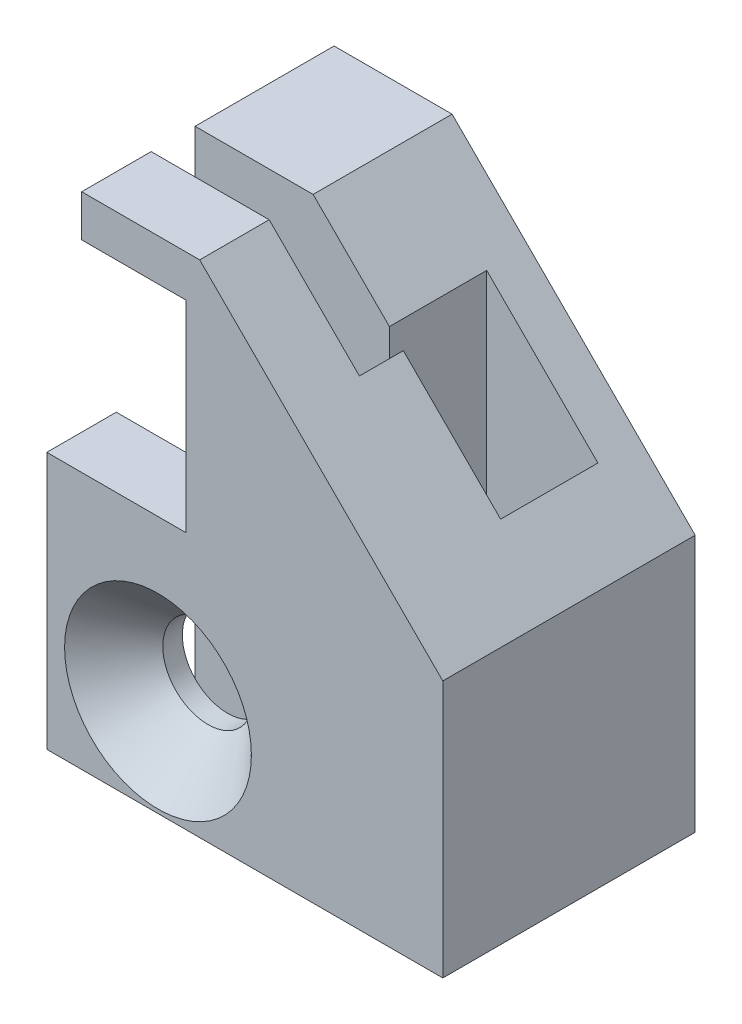
from build123d import *

# Parameters (mm, degrees)
CROQUIS1_R              = 1.625
SALIENTE_EXTRUIR1_DEPTH = 2.5
SALIENTE_EXTRUIR2_DEPTH = 1.58
SALIENTE_EXTRUIR3_START = 3.5
CROQUIS3_R              = 1.625
SALIENTE_EXTRUIR3_DEPTH = 3.5
SALIENTE_EXTRUIR4_START = 1.5
CROQUIS5_R              = 1.625
SALIENTE_EXTRUIR4_DEPTH = 1.5
CORTAR_EXTRUIR1_REACH   = 129.692
CROQUIS6_W              = 3.24530053
CROQUIS6_H              = 1.58
SALIENTE_EXTRUIR5_START = -2.5
CROQUIS7_W              = 1.25469947
CROQUIS7_H              = 9.25469947
SALIENTE_EXTRUIR5_DEPTH = 2.5
CROQUIS8_R              = 3.35997123
CORTAR_EXTRUIR2_DEPTH   = 1.8
CORTAR_EXTRUIR2_DRAFT   = -44
CORTAR_EXTRUIR3_DEPTH   = 2.5


with BuildPart() as part:
    # Croquis1 → Saliente-Extruir1 (new body)
    with BuildSketch(Plane.XY):
        Polygon((-126.24514053, -73.999935), (-113.25453947, -73.999935), (-113.25453947, -64.74523553), (-121.99984, -55.999935), (-126.24514053, -55.999935), (-126.24514053, -57.499935), (-122.49514053, -57.499935), (-122.49514053, -64.74523553), (-126.24514053, -64.74523553), align=None)
        with Locations((-123.49984, -70.499935)):
            Circle(CROQUIS1_R, mode=Mode.SUBTRACT)
    extrude(amount=SALIENTE_EXTRUIR1_DEPTH)

    # Croquis2 → Saliente-Extruir2 (add)
    with BuildSketch(Plane(origin=(0, 0, 0), x_dir=(-1, 0, 0), z_dir=(0, 0, -1))):
        Polygon((119.99984, -57.999935), (119.99984, -71.999935), (121.99984, -73.999935), (113.25453947, -73.999935), (113.25453947, -64.74523553), align=None)
    extrude(amount=SALIENTE_EXTRUIR2_DEPTH)

    # Croquis3 → Saliente-Extruir3 (add)
    # profile 1 of 2: a face of its own
    with BuildSketch(Plane(origin=(0, 0, -1.58), x_dir=(-1, 0, 0), z_dir=(0, 0, -1)).offset(SALIENTE_EXTRUIR3_START)):
        Polygon((113.25453947, -73.999935), (113.25453947, -64.74523553), (115.25453947, -62.74523553), (115.25453947, -73.999935), align=None)
    # profile 2 of 2: a face of its own
    with BuildSketch(Plane(origin=(0, 0, -1.58), x_dir=(-1, 0, 0), z_dir=(0, 0, -1)).offset(SALIENTE_EXTRUIR3_START)):
        Polygon((119.25453947, -73.999935), (121.99984, -73.999935), (126.24514053, -73.999935), (126.24514053, -64.74523553), (126.24514053, -55.999935), (121.99984, -55.999935), (119.99984, -57.999935), (119.25453947, -58.74523553), align=None)
        with Locations(Location((123.49984, -70.499935, 0), (0, 0, 180))):
            Circle(CROQUIS3_R, mode=Mode.SUBTRACT)
    extrude(amount=-SALIENTE_EXTRUIR3_DEPTH)

    # Croquis5 → Saliente-Extruir4 (add)
    with BuildSketch(Plane(origin=(0, 0, -5.08), x_dir=(-1, 0, 0), z_dir=(0, 0, -1)).offset(SALIENTE_EXTRUIR4_START)):
        Polygon((113.25453947, -73.999935), (126.24514053, -73.999935), (126.24514053, -55.999935), (121.99984, -55.999935), (113.25453947, -64.74523553), align=None)
        with Locations(Location((123.49984, -70.499935, 0), (0, 0, 180))):
            Circle(CROQUIS5_R, mode=Mode.SUBTRACT)
    extrude(amount=-SALIENTE_EXTRUIR4_DEPTH)

    # Cortar-Extruir1: up to this plane
    cortar_extruir1_end = Plane(origin=(-113.25453947, -64.74523553, 2.5), z_dir=(-0.7071067811865476, -0.7071067811865476, 0))
    # Croquis6 → Cortar-Extruir1 (cut, up to the surface)
    with BuildSketch(Plane.XZ.offset(73.999935), mode=Mode.PRIVATE) as cortar_extruir1_sk1:
        with Locations((-120.377189735, -0.79)):
            Rectangle(CROQUIS6_W, CROQUIS6_H)
    cortar_extruir1_tool1 = split(extrude(cortar_extruir1_sk1.sketch, amount=-CORTAR_EXTRUIR1_REACH, mode=Mode.PRIVATE), bisect_by=cortar_extruir1_end, keep=Keep.BOTH, mode=Mode.PRIVATE)
    add(cortar_extruir1_tool1.solids().sort_by_distance((-120.37719, -73.999935, -0.79))[0], mode=Mode.SUBTRACT)

    # Croquis7 → Saliente-Extruir5 (add)
    with BuildSketch(Plane.XY.offset(2.5).offset(SALIENTE_EXTRUIR5_START)):
        with Locations((-126.872490265, -69.372585265)):
            Rectangle(CROQUIS7_W, CROQUIS7_H)
    extrude(amount=SALIENTE_EXTRUIR5_DEPTH)


with BuildPart() as cortar_extruir2_tool:
    # Croquis8 → Cortar-Extruir2 (with draft: the straight prism first)
    with BuildSketch(Plane.XY.offset(2.5)):
        with Locations((-123.49984, -70.499935)):
            Circle(CROQUIS8_R)
    extrude(amount=-CORTAR_EXTRUIR2_DEPTH)
    # Cortar-Extruir2: the draft: its side faces are tilted about the plane it starts from
    cortar_extruir2_sides = [cortar_extruir2_tool.faces().sort_by_distance(p)[0] for p in [
        (-126.85981123, -70.499935, 1.6),
    ]]
    draft(cortar_extruir2_sides, Plane.XY.offset(2.5), CORTAR_EXTRUIR2_DRAFT)


with BuildPart() as part_1:
    add(part.part)

    # Cortar-Extruir2: cut by cortar_extruir2_tool
    add(cortar_extruir2_tool.part, mode=Mode.SUBTRACT)

    # Croquis9 → Cortar-Extruir3 (cut)
    with BuildSketch(Plane(origin=(0, 0, -6.58), x_dir=(-1, 0, 0), z_dir=(0, 0, -1))):
        Polygon((120.75453947, -72.084935), (123.49984, -73.669935), (124.071416766, -73.999935), (126.24514053, -73.999935), (126.24514053, -72.084935), (126.24514053, -68.914935), (123.49984, -67.329935), (120.75453947, -68.914935), align=None)
    extrude(amount=-CORTAR_EXTRUIR3_DEPTH, mode=Mode.SUBTRACT)


solid = part_1.part
